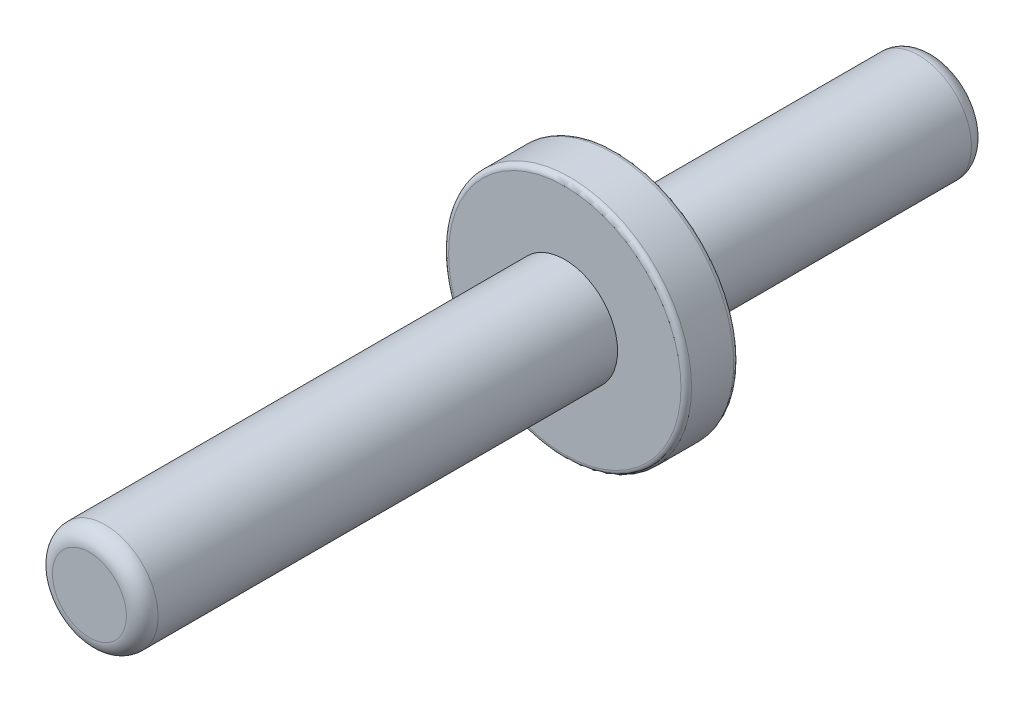
from build123d import *

# Parameters (mm, degrees)
SKETCH1_R           = 2.3
BOSS_EXTRUDE1_DEPTH = 1
SKETCH2_R           = 1
BOSS_EXTRUDE2_DEPTH = 9
BOSS_EXTRUDE3_START = 6
SKETCH3_R           = 1
BOSS_EXTRUDE3_DEPTH = 6
FILLET2_R           = 0.3
FILLET3_R           = 0.1


with BuildPart() as part:
    # Sketch1 → Boss-Extrude1 (new body)
    with BuildSketch(Plane.XY):
        Circle(SKETCH1_R)
    extrude(amount=BOSS_EXTRUDE1_DEPTH)

    # Sketch2 → Boss-Extrude2 (add)
    with BuildSketch(Plane.XY.offset(1)):
        Circle(SKETCH2_R)
    extrude(amount=BOSS_EXTRUDE2_DEPTH)

    # Sketch3 → Boss-Extrude3 (add)
    with BuildSketch(Plane(origin=(0, 0, 0), x_dir=(-1, 0, 0), z_dir=(0, 0, -1)).offset(BOSS_EXTRUDE3_START)):
        with Locations(Location((0, 0, 0), (0, 0, 180))):
            Circle(SKETCH3_R)
    extrude(amount=-BOSS_EXTRUDE3_DEPTH)

    # Fillet2
    fillet2_edges = [part.edges().sort_by_distance(p)[0] for p in [
        (-1, 0, -6),
        (-1, 0, 10),
    ]]
    fillet(fillet2_edges, radius=FILLET2_R)

    # Fillet3
    fillet3_edges = [part.edges().sort_by_distance(p)[0] for p in [
        (-2.3, 0, 0),
        (-2.3, 0, 1),
    ]]
    fillet(fillet3_edges, radius=FILLET3_R)


solid = part.part
